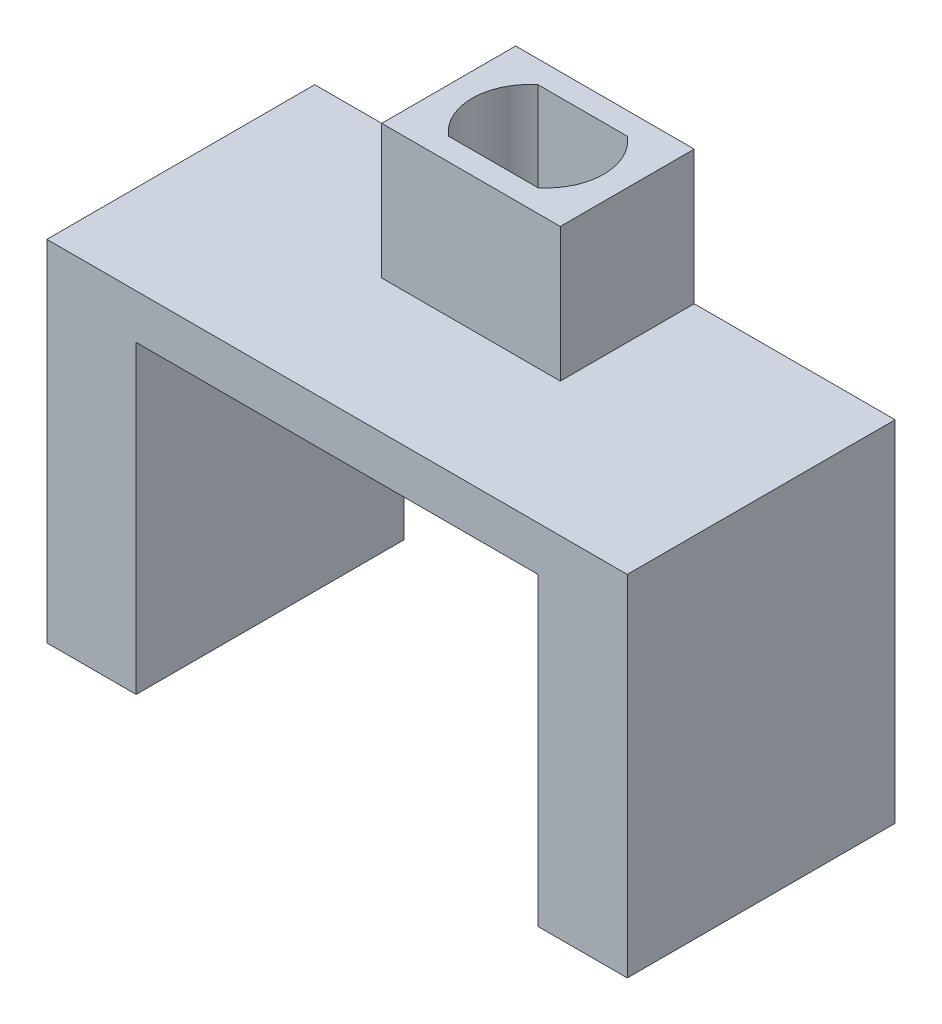
from build123d import *

# Parameters (mm, degrees)
SKETCH1_W           = 65
SKETCH1_H           = 30
BOSS_EXTRUDE1_DEPTH = 5
SKETCH2_W           = 20
SKETCH2_H           = 15
BOSS_EXTRUDE2_DEPTH = 15
CUT_EXTRUDE1_DEPTH  = 15
SKETCH4_R           = 1.852641707
CUT_EXTRUDE2_DEPTH  = 39.810436741
SKETCH5_W           = 10
SKETCH5_H           = 30
BOSS_EXTRUDE3_DEPTH = 34.146213


with BuildPart() as part:
    # Sketch1 → Boss-Extrude1 (new body)
    with BuildSketch(Plane(origin=(0, 0, 0), x_dir=(1, 0, 0), z_dir=(0, 1, 0))):
        Rectangle(SKETCH1_W, SKETCH1_H)
    extrude(amount=BOSS_EXTRUDE1_DEPTH)

    # Sketch2 → Boss-Extrude2 (add)
    with BuildSketch(Plane(origin=(0, 5, 0), x_dir=(1, 0, 0), z_dir=(0, 1, 0))):
        with Locations((0, 7.5)):
            Rectangle(SKETCH2_W, SKETCH2_H)
    extrude(amount=BOSS_EXTRUDE2_DEPTH)

    # Sketch3 → Cut-Extrude1 (cut)
    with BuildSketch(Plane(origin=(0, 20, 0), x_dir=(1, 0, 0), z_dir=(0, 1, 0))):
        with BuildLine():
            Line((-5, 2.5), (5, 2.5))
            ThreePointArc((5, 2.5), (7.375699039, 7.5), (5, 12.5))
            Line((5, 12.5), (-5, 12.5))
            ThreePointArc((-5, 12.5), (-7.375699039, 7.5), (-5, 2.5))
        make_face()
    extrude(amount=-CUT_EXTRUDE1_DEPTH, mode=Mode.SUBTRACT)

    # Sketch4 → Cut-Extrude2 (cut, through all)
    with BuildSketch(Plane(origin=(0, 5, 0), x_dir=(1, 0, 0), z_dir=(0, 1, 0))):
        with Locations(Location((0, 7.5, 0), (0, 0, 270))):
            Circle(SKETCH4_R)
    extrude(amount=-CUT_EXTRUDE2_DEPTH, mode=Mode.SUBTRACT)

    # Sketch5 → Boss-Extrude3 (add)
    with BuildSketch(Plane.XZ):
        with Locations((27.5, 0)):
            Rectangle(SKETCH5_W, SKETCH5_H)
        with Locations((-27.5, 0)):
            Rectangle(SKETCH5_W, SKETCH5_H)
    extrude(amount=BOSS_EXTRUDE3_DEPTH)


solid = part.part
